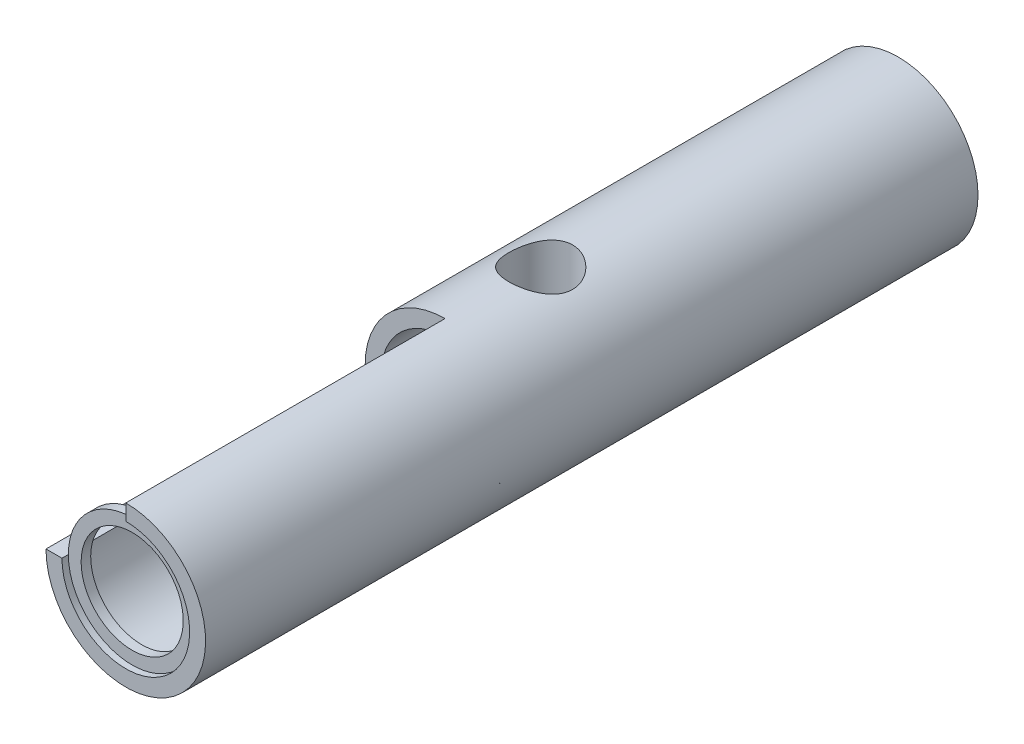
from build123d import *

# Parameters (mm, degrees)
ESQUISSE1_R                  = 12.5
BASE_EXTRUSION_DEPTH         = 121
ESQUISSE2_R                  = 10
ENL_V_MAT_EXTRU_1_DEPTH      = 58
ESQUISSE3_R                  = 4
ENL_V_MAT_EXTRU_2_DEPTH      = 66.433172015
ENL_V_MAT_EXTRU_3_DEPTH      = 15
ENL_V_MAT_EXTRU_3_DEPTH_BACK = 8
ESQUISSE4_R                  = 5
ESQUISSE5_R                  = 3
ENL_V_MAT_EXTRU_4_DEPTH      = 124.35923164
ESQUISSE9_W                  = 55
ESQUISSE9_H                  = 32.337681811
ENL_V_MAT_EXTRU_6_DEPTH      = 123.284504453
ESQUISSE6_W                  = 1.5
ESQUISSE6_H                  = 2


with BuildPart() as part:
    # Esquisse1 → Base-Extrusion (new body)
    with BuildSketch(Plane.XY):
        with Locations(Location((0, 0, 0), (0, 0, 180))):
            Circle(ESQUISSE1_R)
    extrude(amount=BASE_EXTRUSION_DEPTH)

    # Esquisse2 → Enlèv. mat.-Extru.1 (cut)
    with BuildSketch(Plane.XY.offset(121)):
        Circle(ESQUISSE2_R)
    extrude(amount=-ENL_V_MAT_EXTRU_1_DEPTH, mode=Mode.SUBTRACT)

    # Esquisse3 → Enlèv. mat.-Extru.2 (cut, through all)
    with BuildSketch(Plane.XY.offset(63)):
        Circle(ESQUISSE3_R)
    extrude(amount=-ENL_V_MAT_EXTRU_2_DEPTH, mode=Mode.SUBTRACT)

    # Esquisse4 → Enlèv. mat.-Extru.3 (cut, two sides: drawn at the far end of the back side and taken through both)
    with BuildSketch(Plane(origin=(0, 0, 0), x_dir=(-1, 0, 0), z_dir=(0, 1, 0)).offset(-ENL_V_MAT_EXTRU_3_DEPTH_BACK)):
        with Locations(Location((0, 56, 0), (0, 0, 90))):
            Circle(ESQUISSE4_R)
    extrude(amount=ENL_V_MAT_EXTRU_3_DEPTH + ENL_V_MAT_EXTRU_3_DEPTH_BACK, mode=Mode.SUBTRACT)

    # Esquisse5 → Enlèv. mat.-Extru.4 (cut, through all)
    with BuildSketch(Plane(origin=(0, -8, 0), x_dir=(-1, 0, 0), z_dir=(0, 1, 0))):
        with Locations(Location((0, 56, 0), (0, 0, 90))):
            Circle(ESQUISSE5_R)
    extrude(amount=-ENL_V_MAT_EXTRU_4_DEPTH, mode=Mode.SUBTRACT)

    # Esquisse9 → Enlèv. mat.-Extru.6 (cut, through all)
    with BuildSketch(Plane(origin=(0, 0, 0), x_dir=(0, 0, -1), z_dir=(1, 0, 0))):
        with Locations((-98.5, 16.168840906)):
            Rectangle(ESQUISSE9_W, ESQUISSE9_H)
    extrude(amount=-ENL_V_MAT_EXTRU_6_DEPTH, mode=Mode.SUBTRACT)

    # Esquisse6 → Anneau élastique (revolve)
    with BuildSketch(Plane(origin=(0, 0, 0), x_dir=(0, 0, -1), z_dir=(1, 0, 0)), mode=Mode.PRIVATE) as anneau_lastique_sk:
        with Locations((-119.25, 9)):
            Rectangle(ESQUISSE6_W, ESQUISSE6_H)
    revolve(anneau_lastique_sk.sketch.rotate(Axis((0, 0, -6.276986183), (0, 0, 1)), 270), axis=Axis((0, 0, -6.276986183), (0, 0, 1)))


solid = part.part
